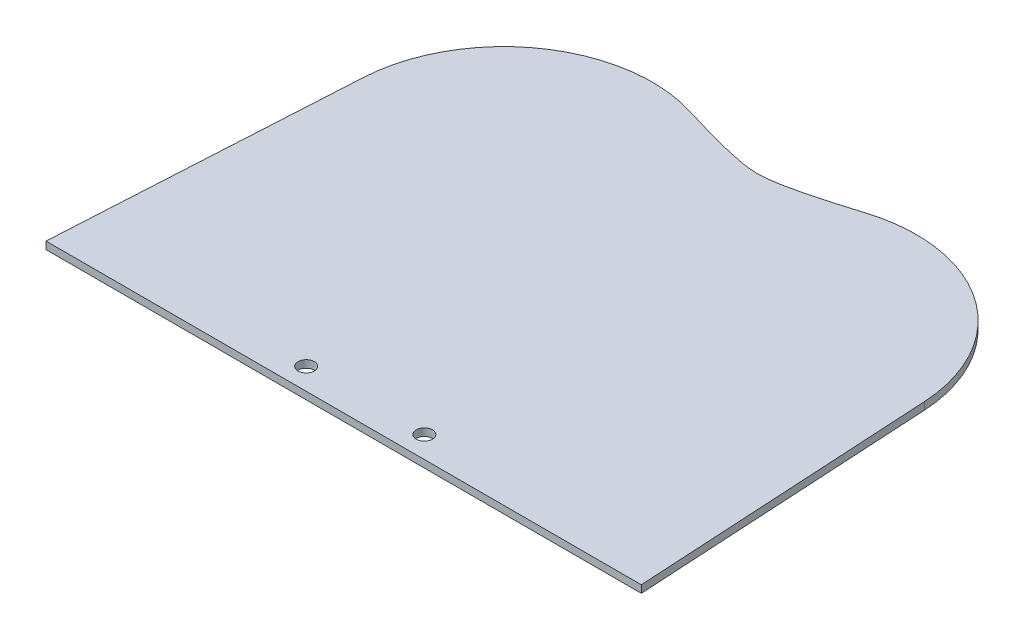
from build123d import *

# Parameters (mm, degrees)
SKETCH1_W           = 160
SKETCH1_H           = 120
BOSS_EXTRUDE1_DEPTH = 2
SKETCH4_R           = 2.185
CUT_EXTRUDE2_DEPTH  = 2
CUT_EXTRUDE4_DEPTH  = 2


with BuildPart() as part:
    # Sketch1 → Boss-Extrude1 (new body)
    with BuildSketch(Plane(origin=(0, 0, 0), x_dir=(1, 0, 0), z_dir=(0, 1, 0))):
        with Locations((80, 60)):
            Rectangle(SKETCH1_W, SKETCH1_H)
    extrude(amount=BOSS_EXTRUDE1_DEPTH)

    # Sketch4 → Cut-Extrude2 (cut)
    with BuildSketch(Plane(origin=(0, 2, 0), x_dir=(1, 0, 0), z_dir=(0, 1, 0))):
        with Locations(Location((95.87, 5.81, 0), (0, 0, 270))):
            Circle(SKETCH4_R)
        with Locations(Location((64.12, 5.81, 0), (0, 0, 270))):
            Circle(SKETCH4_R)
    extrude(amount=-CUT_EXTRUDE2_DEPTH, mode=Mode.SUBTRACT)

    # Sketch7 → Cut-Extrude4 (cut)
    with BuildSketch(Plane(origin=(0, 2, 0), x_dir=(1, 0, 0), z_dir=(0, 1, 0))):
        with BuildLine():
            Line((160, 0), (155.4150618, 80.754175955))
            ThreePointArc((155.4150618, 80.754175955), (138.274614844, 111.355859548), (103.606654186, 116.684129849))
            add(Edge.make_bspline(
                [(103.606654186, 116.684129849), (86.209743463, 111.276722041), (80, 111.276722041)],
                knots=[0, 0, 0, 1, 1, 1], degree=2))
            add(Edge.make_bspline(
                [(56.393345814, 116.684129849), (73.790256537, 111.276722041), (80, 111.276722041)],
                knots=[0, 0, 0, 1, 1, 1], degree=2))
            ThreePointArc((56.393345814, 116.684129849), (21.725385156, 111.355859548), (4.5849382, 80.754175955))
            Line((4.5849382, 80.754175955), (0, 0))
            Line((0, 0), (0, 134.808848477))
            Line((0, 134.808848477), (160, 134.808848477))
            Line((160, 134.808848477), (160, 0))
        make_face()
    extrude(amount=-CUT_EXTRUDE4_DEPTH, mode=Mode.SUBTRACT)


solid = part.part
